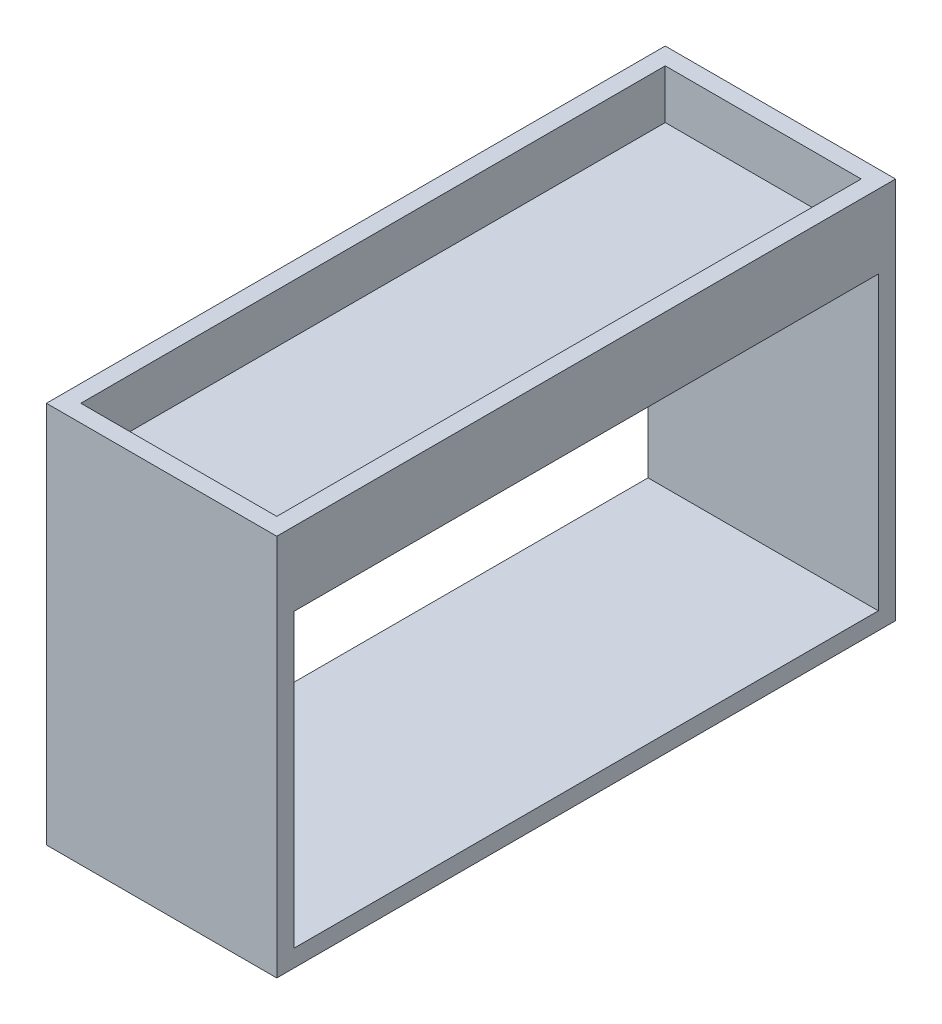
from build123d import *

# Parameters (mm, degrees)
SKETCH1_W           = 469
SKETCH1_H           = 1260
BOSS_EXTRUDE1_DEPTH = 779
SKETCH2_W           = 399
SKETCH2_H           = 1190
CUT_EXTRUDE1_DEPTH  = 100
SKETCH3_W           = 1190
SKETCH3_H           = 594
CUT_EXTRUDE3_DEPTH  = 1107.210649018


with BuildPart() as part:
    # Sketch1 → Boss-Extrude1 (new body)
    with BuildSketch(Plane(origin=(0, 0, 0), x_dir=(1, 0, 0), z_dir=(0, 1, 0))):
        Rectangle(SKETCH1_W, SKETCH1_H)
    extrude(amount=-BOSS_EXTRUDE1_DEPTH)

    # Sketch2 → Cut-Extrude1 (cut)
    with BuildSketch(Plane(origin=(0, 0, 0), x_dir=(1, 0, 0), z_dir=(0, 1, 0))):
        Rectangle(SKETCH2_W, SKETCH2_H)
    extrude(amount=-CUT_EXTRUDE1_DEPTH, mode=Mode.SUBTRACT)

    # Sketch3 → Cut-Extrude3 (cut, through all)
    with BuildSketch(Plane.ZY.offset(234.5)):
        with Locations((0, -447)):
            Rectangle(SKETCH3_W, SKETCH3_H)
    extrude(amount=-CUT_EXTRUDE3_DEPTH, mode=Mode.SUBTRACT)


solid = part.part
